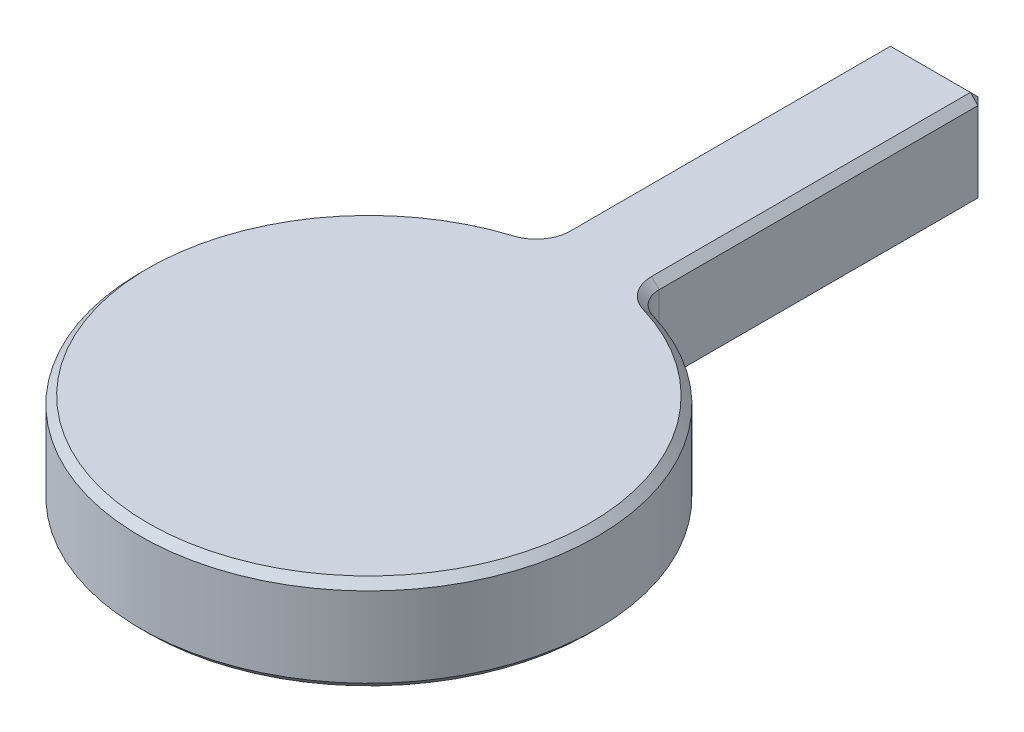
from build123d import *

# Parameters (mm, degrees)
EXTRUDE_1_DEPTH = 5
FILLET_1_R      = 1.4
CHAMFER_1_SIZE  = 0.4


with BuildPart() as part:
    # 草图1 → 凸台-拉伸1 (new body)
    with BuildSketch(Plane(origin=(0, 0, 0), x_dir=(1, 0, 0), z_dir=(0, 1, 0))):
        with BuildLine():
            Line((-0.1, 30), (-2.6, 30))
            Line((-2.6, 30), (-2.6, 11.714947716))
            ThreePointArc((-2.6, 11.714947716), (0.102243606, -11.999564419), (2.4, 11.757550765))
            Line((2.4, 11.757550765), (2.4, 30))
            Line((2.4, 30), (-0.1, 30))
        make_face()
    extrude(amount=EXTRUDE_1_DEPTH)

    # 圆角1
    fillet_1_edges = [part.edges().sort_by_distance(p)[0] for p in [
        (-2.6, 2.5, -11.714947716),
        (2.4, 2.5, -11.757550765),
    ]]
    fillet(fillet_1_edges, radius=FILLET_1_R)

    # 倒角1
    chamfer_1_edges = [part.edges().sort_by_distance(p)[0] for p in [
        (-0.1, 5, -30),
        (2.4, 0, -21.424951362),
        (2.4, 5, -21.424951362),
        (0.093604691, 0, 11.999634918),
        (0.093604691, 5, 11.999634918),
        (-2.6, 5, -21.394528911),
        (2.678433931, 0, -12.011994881),
        (2.678433931, 5, -12.011994881),
        (-2.871932044, 0, -11.959924127),
        (-2.871932044, 5, -11.959924127),
        (-2.6, 0, -21.394528911),
        (-0.1, 0, -30),
        (-2.6, 2.5, -30),
        (2.4, 2.5, -30),
    ]]
    chamfer(chamfer_1_edges, length=CHAMFER_1_SIZE)


solid = part.part
